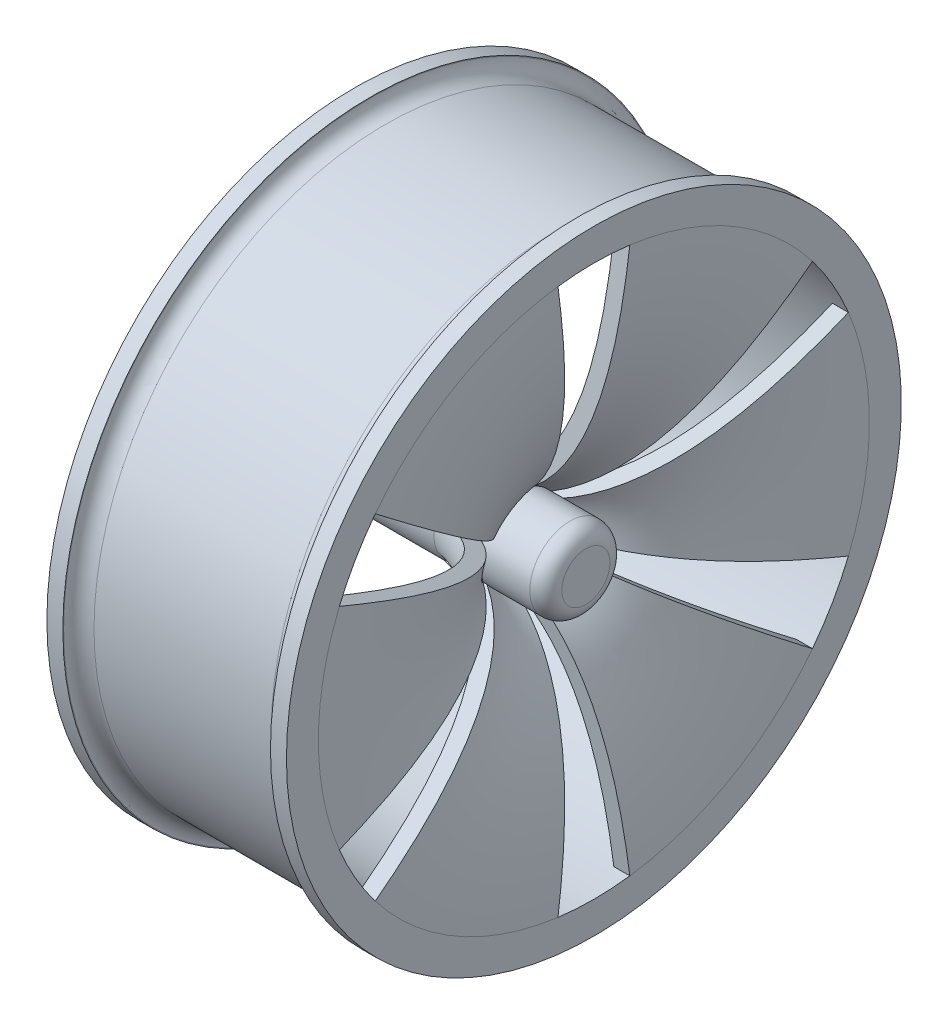
from build123d import *
from build123d.topology import SkipClean

# Parameters (mm, degrees)
SKETCH2_R           = 5.020122089
SKETCH2_R_2         = 3
BOSS_EXTRUDE1_DEPTH = 29
BOSS_EXTRUDE3_START = -2
SKETCH3_R           = 5.020122089
BOSS_EXTRUDE3_DEPTH = 2
CUT_EXTRUDE1_DEPTH  = 63.165100818
CIRPATTERN1_COUNT   = 6
FILLET3_R           = 2


with BuildPart() as part:
    # Sketch1 → Revolve4 (revolve)
    with BuildSketch(Plane.XY, mode=Mode.PRIVATE) as revolve4_sk:
        with BuildLine():
            Line((-15, 34.49999844), (13, 34.49999844))
            add(Edge.make_bspline(
                [(13, 34.49999844), (13, 34.219184436), (12.99897341, 33.672716857), (12.989620984, 32.458516127), (12.958278561, 30.813117704), (12.870225665, 28.651100013), (12.660596318, 25.588993161), (12.179172479, 21.536683393), (11.11046719, 16.697985453), (9.431052506, 12.273816563), (7.463373806, 9.252547426), (5.525781853, 7.373481485), (3.874561657, 6.248305509), (2.294774955, 5.558521675), (0.992894455, 5.198462752), (0.320990337, 5.069937299), (0.021704859, 5.023437752), (0, 5.020122089)],
                knots=[0, 0, 0, 0, 0.03125, 0.0625, 0.125, 0.1875, 0.25, 0.375, 0.5, 0.625, 0.75, 0.8125, 0.875, 0.9375, 0.96875, 0.991244145, 0.992995316, 0.992995316, 0.992995316, 0.992995316], degree=3))
            Line((0, 5.020122089), (0, 3))
            add(Edge.make_bspline(
                [(15, 34.49999844), (15, 25.778867406), (14.469659577, 4.916786833), (0, 3)],
                knots=[0, 0, 0, 0, 1, 1, 1, 1], degree=3))
            Line((15, 34.49999844), (15, 38.49999844))
            Line((15, 38.49999844), (13, 38.49999844))
            Line((13, 38.49999844), (13, 38.39999844))
            ThreePointArc((13, 38.39999844), (12.443502884, 37.056495556), (11.1, 36.49999844))
            Line((11.1, 36.49999844), (-11.1, 36.49999844))
            ThreePointArc((-11.1, 36.49999844), (-12.443502884, 37.056495556), (-13, 38.39999844))
            Line((-13, 38.39999844), (-13, 38.49999844))
            Line((-13, 38.49999844), (-15, 38.49999844))
            Line((-15, 38.49999844), (-15, 34.49999844))
        make_face()
    revolve(revolve4_sk.sketch.rotate(Axis((0, 0, 0), (1, 0, 0)), 90), axis=Axis((0, 0, 0), (1, 0, 0)))

    # Sketch2 → Boss-Extrude1 (add)
    with BuildSketch(Plane.ZY.offset(15)):
        Circle(SKETCH2_R)
        Circle(SKETCH2_R_2, mode=Mode.SUBTRACT)
    extrude(amount=-BOSS_EXTRUDE1_DEPTH)

    # Sketch3 → Boss-Extrude3 (add)
    with BuildSketch(Plane(origin=(14, 0, 0), x_dir=(0, 0, -1), z_dir=(1, 0, 0)).offset(BOSS_EXTRUDE3_START)):
        with Locations(Location((0, 0, 0), (0, 0, 180))):
            Circle(SKETCH3_R)
    extrude(amount=BOSS_EXTRUDE3_DEPTH)

    # Sketch4 → Cut-Extrude1 (cut, through all)
    with BuildSketch(Plane(origin=(15, 0, 0), x_dir=(0, 0, -1), z_dir=(1, 0, 0))):
        with BuildLine():
            Line((-4.5, 34.20526118), (-0.654798563, 4.977234637))
            ThreePointArc((-0.654798563, 4.977234637), (0, 5.020122089), (0.654798563, 4.977234637))
            Line((0.654798563, 4.977234637), (4.5, 34.20526118))
            ThreePointArc((4.5, 34.20526118), (0, 34.49999844), (-4.5, 34.20526118))
        make_face()
    cut_extrude1 = extrude(amount=-CUT_EXTRUDE1_DEPTH, mode=Mode.SUBTRACT)

    # CirPattern1: Cut-Extrude1 ×6 about axis
    with SkipClean():  # the faces are left unmerged after this step: merging them gives an invalid solid
        cirpattern1_axis = Axis((0, 0, 0), (1, 0, 0))
        for i in range(1, CIRPATTERN1_COUNT):
            add(cut_extrude1.rotate(cirpattern1_axis, i * 360 / CIRPATTERN1_COUNT), mode=Mode.SUBTRACT)

    # Fillet3
    fillet3_edges = [part.edges().sort_by_distance(p)[0] for p in [
        (14, -0.979604195, 4.9236167),
    ]]
    fillet(fillet3_edges, radius=FILLET3_R)


solid = part.part
